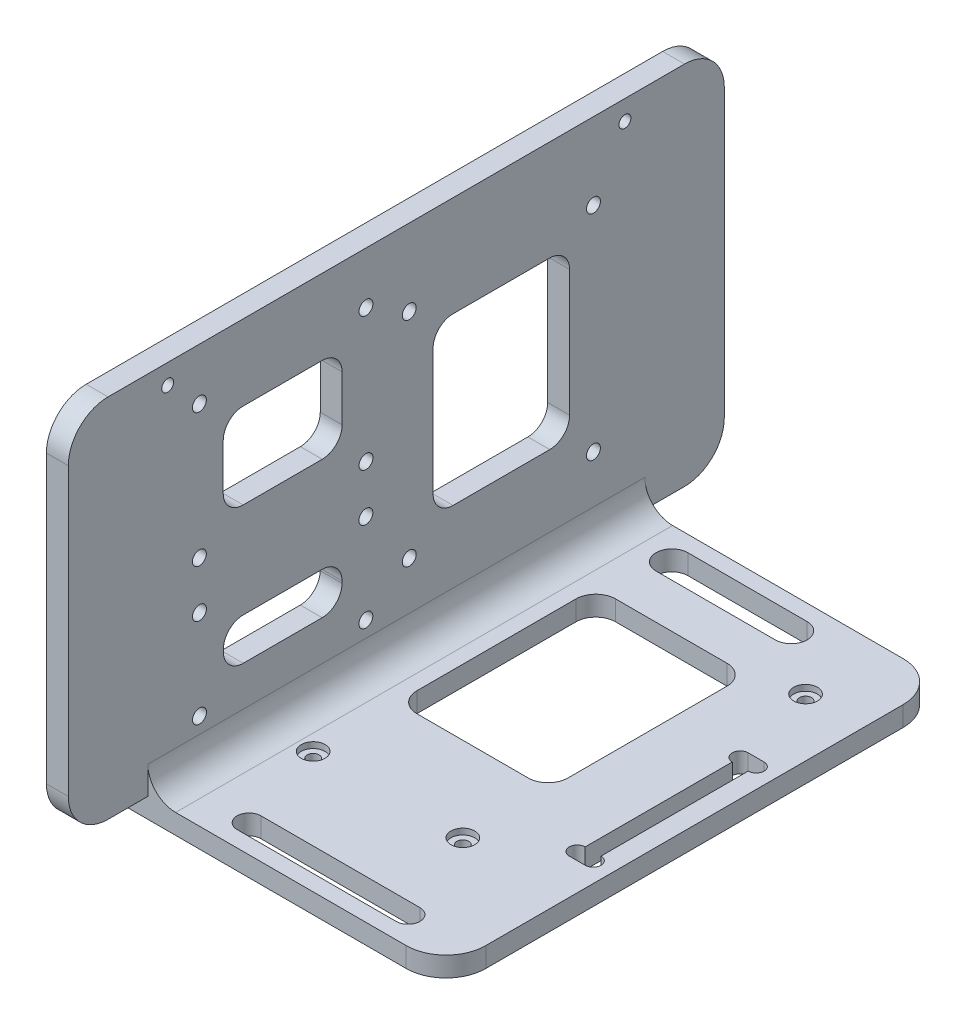
from build123d import *

# Parameters (mm, degrees)
SKETCH_1_W          = 125
SKETCH_1_H          = 92.025
SKETCH_1_R          = 1.75
SKETCH_1_R_2        = 1.5
SKETCH_1_W_2        = 29.91
SKETCH_1_H_2        = 21.53
SKETCH_1_W_3        = 29.85
SKETCH_1_H_3        = 10.52
SKETCH_1_W_4        = 34.33
SKETCH_1_H_4        = 41.73
EXTRUDE_1_DEPTH     = 5.5
FILLET_1_R          = 5
SKETCH_2_R          = 3
SKETCH_2_R_2        = 1.5
SKETCH_2_R_3        = 3.25
SKETCH_2_R_4        = 1.75
CUT_EXTRUDE_1_DEPTH = 2
SKETCH_3_W          = 86.5
SKETCH_3_H          = 125
SKETCH_3_W_2        = 38
SKETCH_3_H_2        = 50
SKETCH_3_R          = 1.5
EXTRUDE_2_DEPTH     = 5
SKETCH_6_R          = 3
SKETCH_6_R_2        = 1.5
CUT_EXTRUDE_2_DEPTH = 1.5
FILLET_3_R          = 7
FILLET_4_R          = 10
SKETCH_7_W          = 5.5
SKETCH_7_H          = 92.025
EXTRUDE_5_DEPTH     = 20
FILLET_6_R          = 5
EXTRUDE_6_DEPTH     = 20
FILLET_5_R          = 10


with BuildPart() as part:
    # 草图1 → 凸台-拉伸1 (new body)
    with BuildSketch(Plane(origin=(0, 0, 0), x_dir=(0, 0, -1), z_dir=(1, 0, 0))):
        with Locations((28.575, 23.7525)):
            Rectangle(SKETCH_1_W, SKETCH_1_H)
        with Locations((-20.925, 11.26)):
            Circle(SKETCH_1_R, mode=Mode.SUBTRACT)
        with Locations((20.925, 11.26)):
            Circle(SKETCH_1_R, mode=Mode.SUBTRACT)
        with Locations((20.925, -11.26)):
            Circle(SKETCH_1_R, mode=Mode.SUBTRACT)
        with Locations((-20.925, -11.26)):
            Circle(SKETCH_1_R, mode=Mode.SUBTRACT)
        with Locations((-20.955, 56.765)):
            Circle(SKETCH_1_R, mode=Mode.SUBTRACT)
        with Locations((20.955, 56.765)):
            Circle(SKETCH_1_R, mode=Mode.SUBTRACT)
        with Locations((20.955, 23.235)):
            Circle(SKETCH_1_R, mode=Mode.SUBTRACT)
        with Locations((-20.955, 23.235)):
            Circle(SKETCH_1_R, mode=Mode.SUBTRACT)
        with Locations((31.835, 50.47)):
            Circle(SKETCH_1_R, mode=Mode.SUBTRACT)
        with Locations((78.165, 50.47)):
            Circle(SKETCH_1_R, mode=Mode.SUBTRACT)
        with Locations((78.165, -3.26)):
            Circle(SKETCH_1_R, mode=Mode.SUBTRACT)
        with Locations((31.835, -3.26)):
            Circle(SKETCH_1_R, mode=Mode.SUBTRACT)
        with Locations((-28.925, 64.765)):
            Circle(SKETCH_1_R_2, mode=Mode.SUBTRACT)
        with Locations((86.075, 64.765)):
            Circle(SKETCH_1_R_2, mode=Mode.SUBTRACT)
        with Locations((0, 40)):
            Rectangle(SKETCH_1_W_2, SKETCH_1_H_2, mode=Mode.SUBTRACT)
        Rectangle(SKETCH_1_W_3, SKETCH_1_H_3, mode=Mode.SUBTRACT)
        with Locations((55, 23.605)):
            Rectangle(SKETCH_1_W_4, SKETCH_1_H_4, mode=Mode.SUBTRACT)
    extrude(amount=EXTRUDE_1_DEPTH)

    # 圆角1
    fillet_1_edges = [part.edges().sort_by_distance(p)[0] for p in [
        (2.75, 50.765, 14.955),
        (2.75, 29.235, 14.955),
        (2.75, 29.235, -14.955),
        (2.75, 50.765, -14.955),
        (2.75, 5.26, -14.925),
        (2.75, 5.26, 14.925),
        (2.75, -5.26, 14.925),
        (2.75, -5.26, -14.925),
        (2.75, 44.47, -72.165),
        (2.75, 44.47, -37.835),
        (2.75, 2.74, -37.835),
        (2.75, 2.74, -72.165),
    ]]
    fillet(fillet_1_edges, radius=FILLET_1_R)

    # 草图2 → 切除-拉伸1 (cut)
    # profile 1 of 14: a face of its own
    with BuildSketch(Plane.ZY):
        with Locations((-86.075, 64.765)):
            Circle(SKETCH_2_R)
        with Locations((-86.075, 64.765)):
            Circle(SKETCH_2_R_2, mode=Mode.SUBTRACT)
    # profile 2 of 14: a face of its own
    with BuildSketch(Plane.ZY):
        with Locations((-78.165, 50.47)):
            Circle(SKETCH_2_R_3)
        with Locations((-78.165, 50.47)):
            Circle(SKETCH_2_R_4, mode=Mode.SUBTRACT)
    # profile 3 of 14: a face of its own
    with BuildSketch(Plane.ZY):
        with Locations((-31.835, 50.47)):
            Circle(SKETCH_2_R_3)
        with Locations((-31.835, 50.47)):
            Circle(SKETCH_2_R_4, mode=Mode.SUBTRACT)
    # profile 4 of 14: a face of its own
    with BuildSketch(Plane.ZY):
        with Locations((-78.165, -3.26)):
            Circle(SKETCH_2_R_3)
        with Locations((-78.165, -3.26)):
            Circle(SKETCH_2_R_4, mode=Mode.SUBTRACT)
    # profile 5 of 14: a face of its own
    with BuildSketch(Plane.ZY):
        with Locations((-31.835, -3.26)):
            Circle(SKETCH_2_R_3)
        with Locations((-31.835, -3.26)):
            Circle(SKETCH_2_R_4, mode=Mode.SUBTRACT)
    # profile 6 of 14: a face of its own
    with BuildSketch(Plane.ZY):
        with Locations((-20.925, -11.26)):
            Circle(SKETCH_2_R_3)
        with Locations((-20.925, -11.26)):
            Circle(SKETCH_2_R_4, mode=Mode.SUBTRACT)
    # profile 7 of 14: a face of its own
    with BuildSketch(Plane.ZY):
        with Locations((-20.955, 23.235)):
            Circle(SKETCH_2_R_3)
        with Locations((-20.955, 23.235)):
            Circle(SKETCH_2_R_4, mode=Mode.SUBTRACT)
    # profile 8 of 14: a face of its own
    with BuildSketch(Plane.ZY):
        with Locations((-20.925, 11.26)):
            Circle(SKETCH_2_R_3)
        with Locations((-20.925, 11.26)):
            Circle(SKETCH_2_R_4, mode=Mode.SUBTRACT)
    # profile 9 of 14: a face of its own
    with BuildSketch(Plane.ZY):
        with Locations((20.955, 56.765)):
            Circle(SKETCH_2_R_3)
        with Locations((20.955, 56.765)):
            Circle(SKETCH_2_R_4, mode=Mode.SUBTRACT)
    # profile 10 of 14: a face of its own
    with BuildSketch(Plane.ZY):
        with Locations((28.925, 64.765)):
            Circle(SKETCH_2_R)
        with Locations((28.925, 64.765)):
            Circle(SKETCH_2_R_2, mode=Mode.SUBTRACT)
    # profile 11 of 14: a face of its own
    with BuildSketch(Plane.ZY):
        with Locations((20.955, 23.235)):
            Circle(SKETCH_2_R_3)
        with Locations((20.955, 23.235)):
            Circle(SKETCH_2_R_4, mode=Mode.SUBTRACT)
    # profile 12 of 14: a face of its own
    with BuildSketch(Plane.ZY):
        with Locations((20.925, 11.26)):
            Circle(SKETCH_2_R_3)
        with Locations((20.925, 11.26)):
            Circle(SKETCH_2_R_4, mode=Mode.SUBTRACT)
    # profile 13 of 14: a face of its own
    with BuildSketch(Plane.ZY):
        with Locations((20.925, -11.26)):
            Circle(SKETCH_2_R_3)
        with Locations((20.925, -11.26)):
            Circle(SKETCH_2_R_4, mode=Mode.SUBTRACT)
    # profile 14 of 14: a face of its own
    with BuildSketch(Plane.ZY):
        with Locations((-20.955, 56.765)):
            Circle(SKETCH_2_R_3)
    extrude(amount=-CUT_EXTRUDE_1_DEPTH, mode=Mode.SUBTRACT)

    # 草图3 → 凸台-拉伸2 (add)
    with BuildSketch(Plane.XZ.offset(22.26)):
        with Locations((37.25, -28.575)):
            Rectangle(SKETCH_3_W, SKETCH_3_H)
        with BuildLine():
            ThreePointArc((50.325, -79.075), (54.325, -83.075), (50.325, -87.075))
            Line((50.325, -87.075), (20.325, -87.075))
            ThreePointArc((20.325, -87.075), (16.325, -83.075), (20.325, -79.075))
            Line((20.325, -79.075), (50.325, -79.075))
        make_face(mode=Mode.SUBTRACT)
        with Locations((35.325, -42.922390802)):
            Rectangle(SKETCH_3_W_2, SKETCH_3_H_2, mode=Mode.SUBTRACT)
        with Locations(Location((65.94, -71.075, 0), (0, 0, 270))):
            Circle(SKETCH_3_R, mode=Mode.SUBTRACT)
        with BuildLine():
            ThreePointArc((71.5, -10.075), (69.5, -8.075), (71.5, -6.075))
            Line((71.5, -6.075), (75.5, -6.075))
            ThreePointArc((75.5, -6.075), (77.5, -8.075), (75.5, -10.075))
            Line((75.5, -10.075), (75.5, -47.075))
            ThreePointArc((75.5, -47.075), (77.5, -49.075), (75.5, -51.075))
            Line((75.5, -51.075), (71.5, -51.075))
            ThreePointArc((71.5, -51.075), (69.5, -49.075), (71.5, -47.075))
            Line((71.5, -47.075), (71.5, -10.075))
        make_face(mode=Mode.SUBTRACT)
        with Locations(Location((16.5, 3.335, 0), (0, 0, 270))):
            Circle(SKETCH_3_R, mode=Mode.SUBTRACT)
        with Locations(Location((54.15, 3.335, 0), (0, 0, 270))):
            Circle(SKETCH_3_R, mode=Mode.SUBTRACT)
        with BuildLine():
            ThreePointArc((63.961913607, 29.925), (66.961913607, 26.925), (63.961913607, 23.925))
            Line((63.961913607, 23.925), (23.961913607, 23.925))
            ThreePointArc((23.961913607, 23.925), (20.961913607, 26.925), (23.961913607, 29.925))
            Line((23.961913607, 29.925), (63.961913607, 29.925))
        make_face(mode=Mode.SUBTRACT)
    extrude(amount=EXTRUDE_2_DEPTH)

    # 草图6 → 切除-拉伸2 (cut)
    # profile 1 of 3: a face of its own
    with BuildSketch(Plane(origin=(0, -22.26, 0), x_dir=(1, 0, 0), z_dir=(0, 1, 0))):
        with Locations(Location((65.94, 71.075, 0), (0, 0, 270))):
            Circle(SKETCH_6_R)
        with Locations(Location((65.94, 71.075, 0), (0, 0, 270))):
            Circle(SKETCH_6_R_2, mode=Mode.SUBTRACT)
    # profile 2 of 3: a face of its own
    with BuildSketch(Plane(origin=(0, -22.26, 0), x_dir=(1, 0, 0), z_dir=(0, 1, 0))):
        with Locations(Location((54.15, -3.335, 0), (0, 0, 270))):
            Circle(SKETCH_6_R)
        with Locations(Location((54.15, -3.335, 0), (0, 0, 270))):
            Circle(SKETCH_6_R_2, mode=Mode.SUBTRACT)
    # profile 3 of 3: a face of its own
    with BuildSketch(Plane(origin=(0, -22.26, 0), x_dir=(1, 0, 0), z_dir=(0, 1, 0))):
        with Locations(Location((16.5, -3.335, 0), (0, 0, 270))):
            Circle(SKETCH_6_R)
        with Locations(Location((16.5, -3.335, 0), (0, 0, 270))):
            Circle(SKETCH_6_R_2, mode=Mode.SUBTRACT)
    extrude(amount=-CUT_EXTRUDE_2_DEPTH, mode=Mode.SUBTRACT)

    # 圆角3
    fillet_3_edges = [part.edges().sort_by_distance(p)[0] for p in [
        (5.5, -22.26, -28.575),
    ]]
    fillet(fillet_3_edges, radius=FILLET_3_R)

    # 圆角4
    fillet_4_edges = [part.edges().sort_by_distance(p)[0] for p in [
        (80.5, -24.76, -91.075),
        (80.5, -24.76, 33.925),
    ]]
    fillet(fillet_4_edges, radius=FILLET_4_R)

    # 草图7 → 凸台-拉伸5 (add)
    with BuildSketch(Plane.XY.offset(33.925)):
        with Locations((2.75, 23.7525)):
            Rectangle(SKETCH_7_W, SKETCH_7_H)
    extrude(amount=EXTRUDE_5_DEPTH)

    # 圆角6
    fillet_6_edges = [part.edges().sort_by_distance(p)[0] for p in [
        (-6, -24.76, -91.075),
        (16.325, -24.76, -67.922390802),
        (16.325, -24.76, -17.922390802),
        (54.325, -24.76, -17.922390802),
        (-6, -24.76, 33.925),
        (54.325, -24.76, -67.922390802),
    ]]
    fillet(fillet_6_edges, radius=FILLET_6_R)

    # 草图8 → 凸台-拉伸6 (add)
    with BuildSketch(Plane(origin=(0, 0, -91.075), x_dir=(-1, 0, 0), z_dir=(0, 0, -1))):
        Polygon((-5.5, -22.26), (-5.5, -15.26), (-5.5, 69.765), (0, 69.765), (0, -22.26), align=None)
    extrude(amount=EXTRUDE_6_DEPTH)

    # 圆角5
    fillet_5_edges = [part.edges().sort_by_distance(p)[0] for p in [
        (2.75, -22.26, 53.925),
        (2.75, 69.765, 53.925),
        (2.75, -22.26, -111.075),
        (2.75, 69.765, -111.075),
    ]]
    fillet(fillet_5_edges, radius=FILLET_5_R)


solid = part.part
